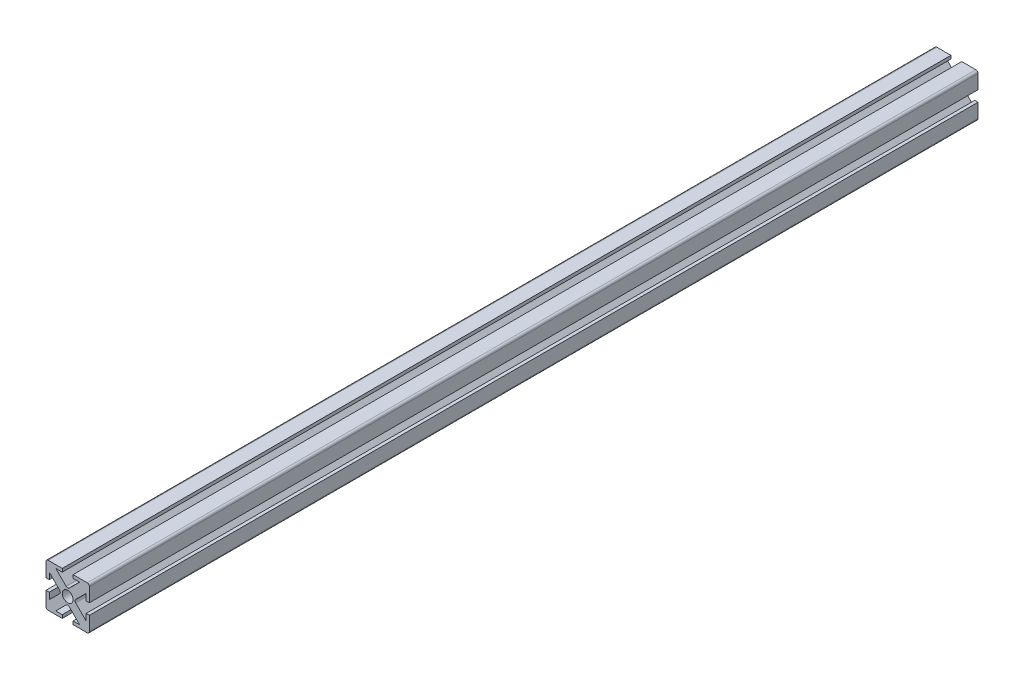
from build123d import *

# Parameters (mm, degrees)
SKETCH_1_R      = 2500
EXTRUDE_1_DEPTH = 410000
FILLET_1_R      = 1000
FILLET_2_R      = 1000


with BuildPart() as part:
    # 草圖1 → 填料-伸長1 (new body)
    with BuildSketch(Plane.XY):
        Polygon((-2500, 10000), (-2500, 8500), (-5500, 8500), (0, 3000), (5500, 8500), (2500, 8500), (2500, 10000), (10000, 10000), (10000, 2500), (8500, 2500), (8500, 5500), (3000, 0), (8500, -5500), (8500, -2500), (10000, -2500), (10000, -10000), (2500, -10000), (2500, -8500), (5500, -8500), (0, -3000), (-5500, -8500), (-2500, -8500), (-2500, -10000), (-10000, -10000), (-10000, -2500), (-8500, -2500), (-8500, -5500), (-3000, 0), (-8500, 5500), (-8500, 2500), (-10000, 2500), (-10000, 10000), align=None)
        Circle(SKETCH_1_R, mode=Mode.SUBTRACT)
    extrude(amount=EXTRUDE_1_DEPTH)

    # 圓角1
    fillet_1_edges = [part.edges().sort_by_distance(p)[0] for p in [
        (0, -3000, 205000),
        (-3000, 0, 205000),
        (0, 3000, 205000),
        (3000, 0, 205000),
    ]]
    fillet(fillet_1_edges, radius=FILLET_1_R)

    # 圓角2
    fillet_2_edges = [part.edges().sort_by_distance(p)[0] for p in [
        (-10000, -10000, 205000),
        (-10000, 10000, 205000),
        (10000, 10000, 205000),
        (10000, -10000, 205000),
    ]]
    fillet(fillet_2_edges, radius=FILLET_2_R)


solid = part.part
